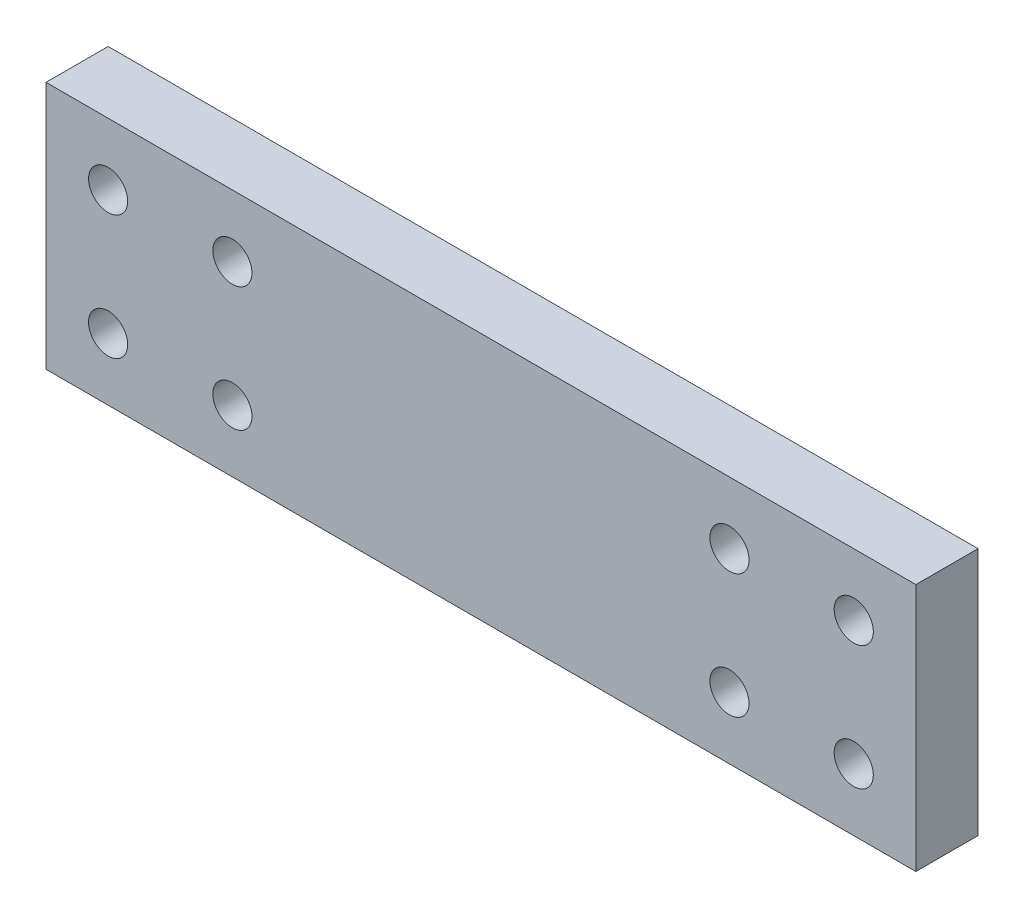
from build123d import *

# Parameters (mm, degrees)
SKETCH_1_W          = 70
SKETCH_1_H          = 20
EXTRUDE_1_DEPTH     = 5
SKETCH_2_R          = 1.575
CUT_EXTRUDE_1_DEPTH = 73.972597597


with BuildPart() as part:
    # 草图1 → 凸台-拉伸1 (new body)
    with BuildSketch(Plane.XY):
        with Locations((35, -10)):
            Rectangle(SKETCH_1_W, SKETCH_1_H)
    extrude(amount=EXTRUDE_1_DEPTH)

    # 草图2 → 切除-拉伸1 (cut, through all)
    with BuildSketch(Plane.XY.offset(5)):
        with Locations((5, -5)):
            Circle(SKETCH_2_R)
        with Locations(Location((5, -15, 0), (0, 0, 180))):
            Circle(SKETCH_2_R)
        with Locations((15, -15)):
            Circle(SKETCH_2_R)
        with Locations(Location((15, -5, 0), (0, 0, 180))):
            Circle(SKETCH_2_R)
        with Locations((55, -5)):
            Circle(SKETCH_2_R)
        with Locations(Location((55, -15, 0), (0, 0, 180))):
            Circle(SKETCH_2_R)
        with Locations((65, -15)):
            Circle(SKETCH_2_R)
        with Locations(Location((65, -5, 0), (0, 0, 180))):
            Circle(SKETCH_2_R)
    extrude(amount=-CUT_EXTRUDE_1_DEPTH, mode=Mode.SUBTRACT)


solid = part.part
